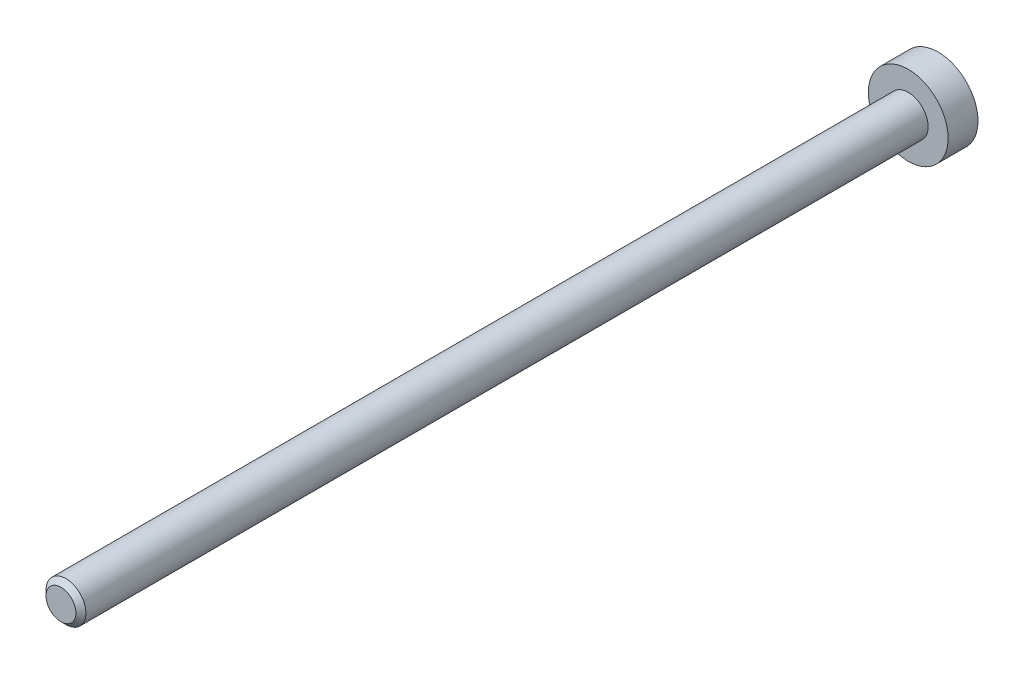
from build123d import *

# Parameters (mm, degrees)
SKETCH1_R           = 4
BOSS_EXTRUDE1_DEPTH = 3
SKETCH2_R           = 2
BOSS_EXTRUDE2_DEPTH = 85
CHAMFER2_SIZE       = 0.5


with BuildPart() as part:
    # Sketch1 → Boss-Extrude1 (new body)
    with BuildSketch(Plane.XY):
        Circle(SKETCH1_R)
    extrude(amount=BOSS_EXTRUDE1_DEPTH)

    # Sketch2 → Boss-Extrude2 (add)
    with BuildSketch(Plane.XY.offset(3)):
        Circle(SKETCH2_R)
    extrude(amount=BOSS_EXTRUDE2_DEPTH)

    # Chamfer2
    chamfer2_edges = [part.edges().sort_by_distance(p)[0] for p in [
        (-2, 0, 88),
    ]]
    chamfer(chamfer2_edges, length=CHAMFER2_SIZE)


solid = part.part
